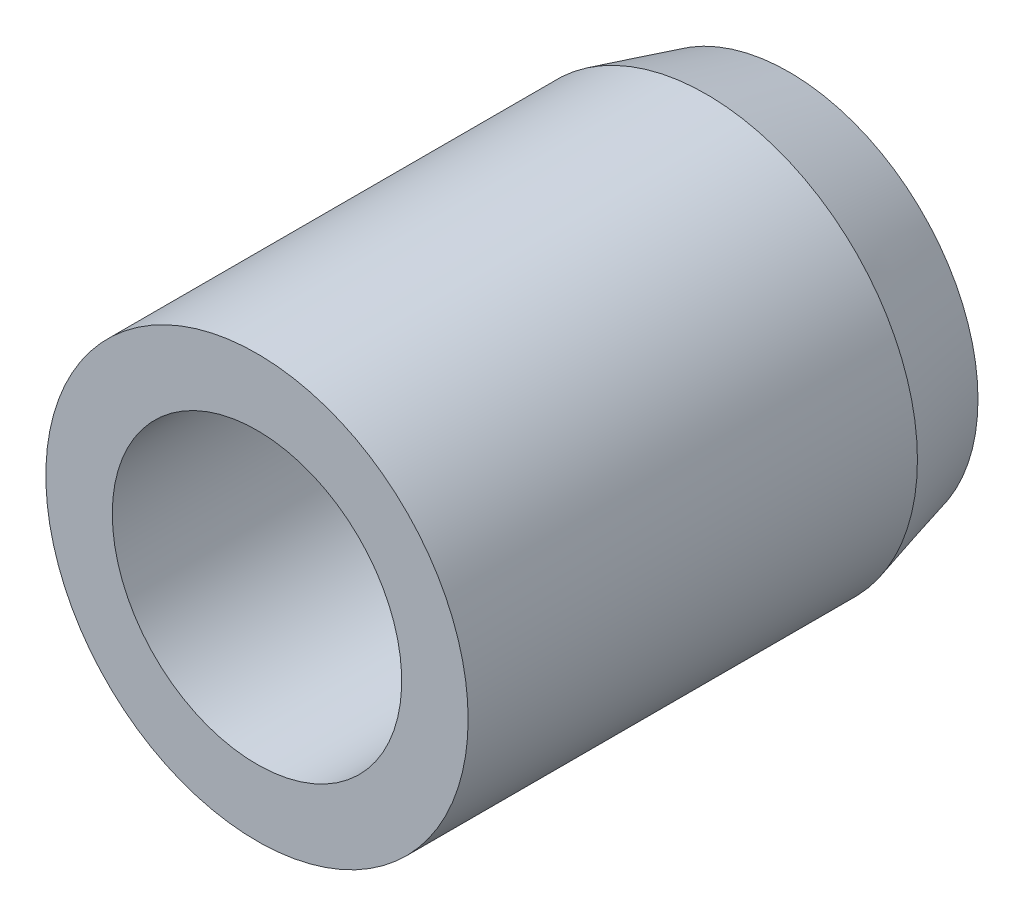
from build123d import *

# Parameters (mm, degrees)
ESBO_O1_R                                  = 4.7625
RESSALTO_EXTRUS_O1_DEPTH                   = 12
CHANFRO1_SIZE                              = 0.5
CHANFRO1_SIZE2                             = 1.866025404
BROCA_DE_ROSQUEAR_PARA_TARRAXA_DE_5_16_1_D = 6.5278


with BuildPart() as part:
    # Esboço1 → Ressalto-extrusão1 (new body)
    with BuildSketch(Plane.XY):
        Circle(ESBO_O1_R)
    extrude(amount=RESSALTO_EXTRUS_O1_DEPTH)

    # Chanfro1
    chanfro1_edges = [part.edges().sort_by_distance(p)[0] for p in [
        (-4.7625, 0, 0),
    ]]
    chanfro1_side = [part.faces().sort_by_distance(p)[0] for p in [
        (0, 0, 0),
    ]]
    chamfer(chanfro1_edges, length=CHANFRO1_SIZE, length2=CHANFRO1_SIZE2, reference=chanfro1_side[0])

    # Broca de rosquear para tarraxa de 5/16-181 (through all)
    with Locations(Plane(origin=(0, 0, 0), x_dir=(-1, 0, 0), z_dir=(0, 0, -1))):
        with Locations((0, 0)):
            Hole(BROCA_DE_ROSQUEAR_PARA_TARRAXA_DE_5_16_1_D / 2)


solid = part.part
